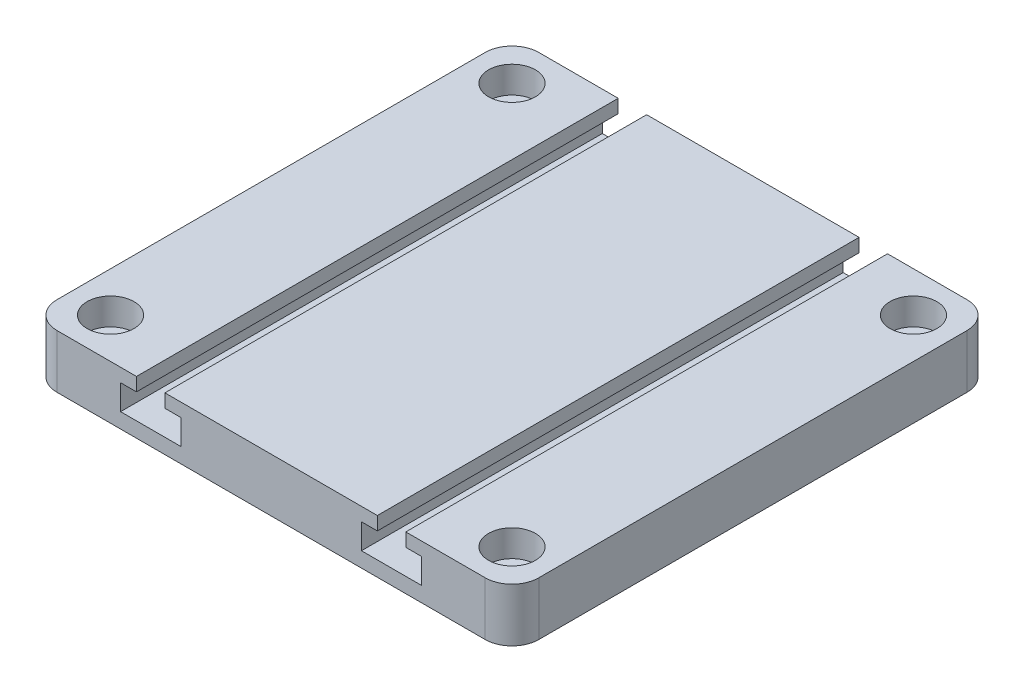
from build123d import *

# Parameters (mm, degrees)
SKETCH1_W                                        = 114.3
SKETCH1_H                                        = 114.3
BOSS_EXTRUDE1_DEPTH                              = 12.7
CBORE_FOR_1_4_SOCKET_HEAD_CAP_SCREW1_D           = 6.5278
CBORE_FOR_1_4_SOCKET_HEAD_CAP_SCREW1_CBORE_D     = 11.1125
CBORE_FOR_1_4_SOCKET_HEAD_CAP_SCREW1_CBORE_DEPTH = 6.35
T_SLOT_CUT_WITH_MCMASTER_8789A16_BIT_DEPTH       = 129.420802443
FILLET1_R                                        = 6.35


with BuildPart() as part:
    # Sketch1 → Boss-Extrude1 (new body)
    with BuildSketch(Plane(origin=(0, 0, 0), x_dir=(1, 0, 0), z_dir=(0, 1, 0))):
        Rectangle(SKETCH1_W, SKETCH1_H)
    extrude(amount=BOSS_EXTRUDE1_DEPTH)

    # CBORE for 1/4 Socket Head Cap Screw1 (through all)
    with Locations(Plane(origin=(0, 12.7, 0), x_dir=(1, 0, 0), z_dir=(0, 1, 0))):
        with Locations((-47.625, 47.625), (47.625, 47.625), (47.625, -47.625), (-47.625, -47.625)):
            CounterBoreHole(CBORE_FOR_1_4_SOCKET_HEAD_CAP_SCREW1_D / 2, CBORE_FOR_1_4_SOCKET_HEAD_CAP_SCREW1_CBORE_D / 2, CBORE_FOR_1_4_SOCKET_HEAD_CAP_SCREW1_CBORE_DEPTH)

    # Sketch4 → T-SLOT CUT WITH MCMASTER 8789A16 BIT (cut, through all)
    with BuildSketch(Plane.XY.offset(57.15)):
        Polygon((-31.9484375, 12.7), (-31.9484375, 9.525), (-35.71875, 9.525), (-35.71875, 3.571875), (-21.43125, 3.571875), (-21.43125, 9.525), (-25.2015625, 9.525), (-25.2015625, 12.7), align=None)
        Polygon((25.2015625, 9.525), (25.2015625, 12.7), (31.9484375, 12.7), (31.9484375, 9.525), (35.71875, 9.525), (35.71875, 3.571875), (21.43125, 3.571875), (21.43125, 9.525), align=None)
    extrude(amount=-T_SLOT_CUT_WITH_MCMASTER_8789A16_BIT_DEPTH, mode=Mode.SUBTRACT)

    # Fillet1
    fillet1_edges = [part.edges().sort_by_distance(p)[0] for p in [
        (57.15, 6.35, 57.15),
        (-57.15, 6.35, 57.15),
        (-57.15, 6.35, -57.15),
        (57.15, 6.35, -57.15),
    ]]
    fillet(fillet1_edges, radius=FILLET1_R)


solid = part.part
